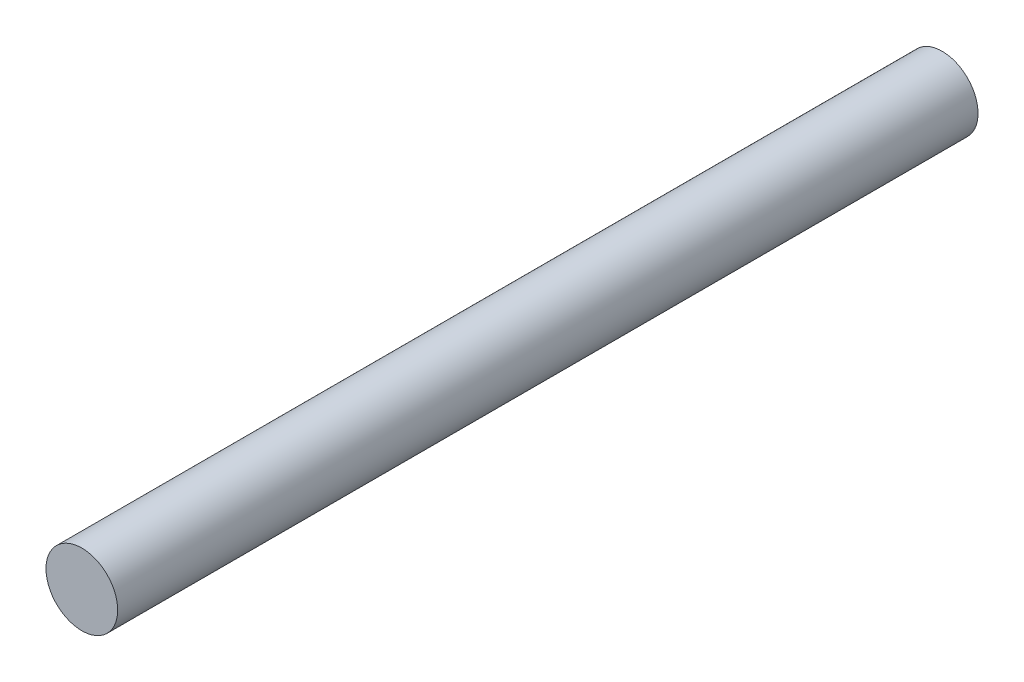
from build123d import *

# Parameters (mm, degrees)
SKETCH1_R           = 1.5875
BOSS_EXTRUDE1_DEPTH = 38.1


with BuildPart() as part:
    # Sketch1 → Boss-Extrude1 (new body)
    with BuildSketch(Plane.XY):
        with Locations(Location((0, 0, 0), (0, 0, 180))):
            Circle(SKETCH1_R)
    extrude(amount=BOSS_EXTRUDE1_DEPTH)


solid = part.part
